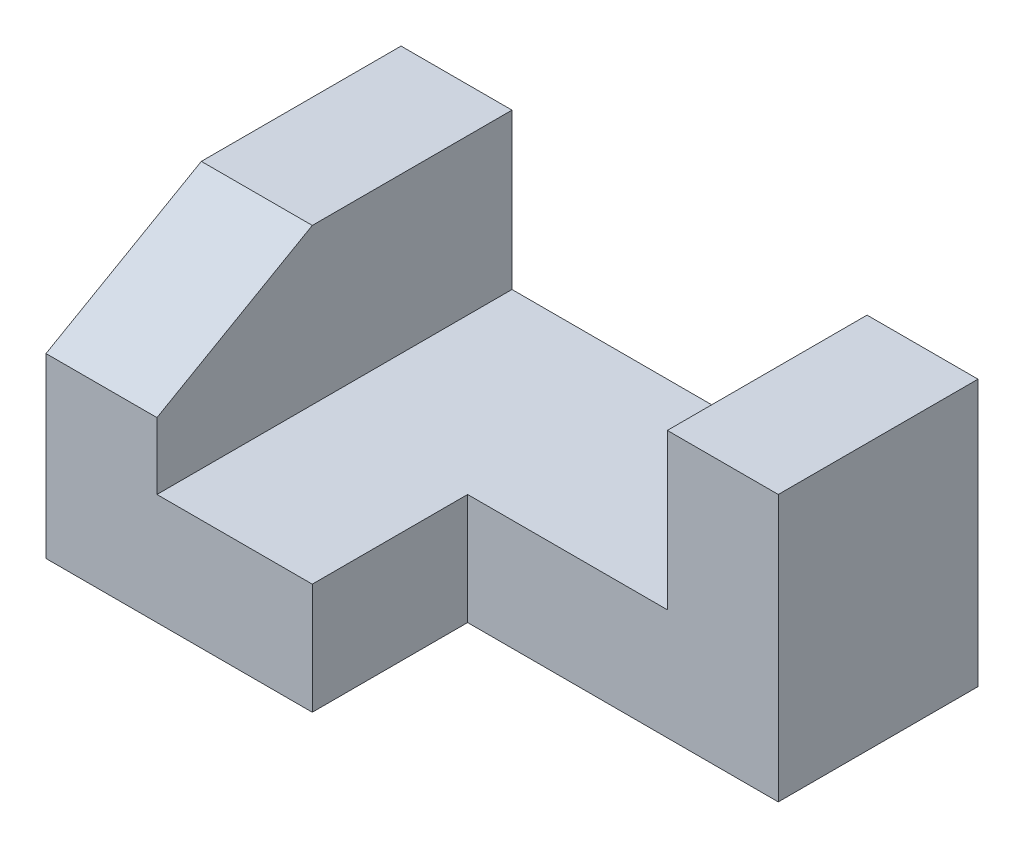
from build123d import *

# Parameters (mm, degrees)
BOSS_EXTRUDE1_DEPTH = 25
BOSS_EXTRUDE2_DEPTH = 25
SKETCH3_W           = 45
SKETCH3_H           = 35
BOSS_EXTRUDE3_DEPTH = 25


with BuildPart() as part:
    # Sketch1 → Boss-Extrude1 (new body)
    with BuildSketch(Plane(origin=(0, 0, 0), x_dir=(1, 0, 0), z_dir=(0, 1, 0))):
        Polygon((0, 0), (60, 0), (60, 35), (130, 35), (130, 80), (0, 80), align=None)
    extrude(amount=BOSS_EXTRUDE1_DEPTH)

    # Sketch2 → Boss-Extrude2 (add)
    with BuildSketch(Plane.ZY):
        Polygon((0, 40), (-35, 60), (-80, 60), (-80, 25), (0, 25), align=None)
    extrude(amount=-BOSS_EXTRUDE2_DEPTH)

    # Sketch3 → Boss-Extrude3 (add)
    with BuildSketch(Plane(origin=(130, 0, 0), x_dir=(0, 0, -1), z_dir=(1, 0, 0))):
        with Locations((57.5, 42.5)):
            Rectangle(SKETCH3_W, SKETCH3_H)
    extrude(amount=-BOSS_EXTRUDE3_DEPTH)


solid = part.part
